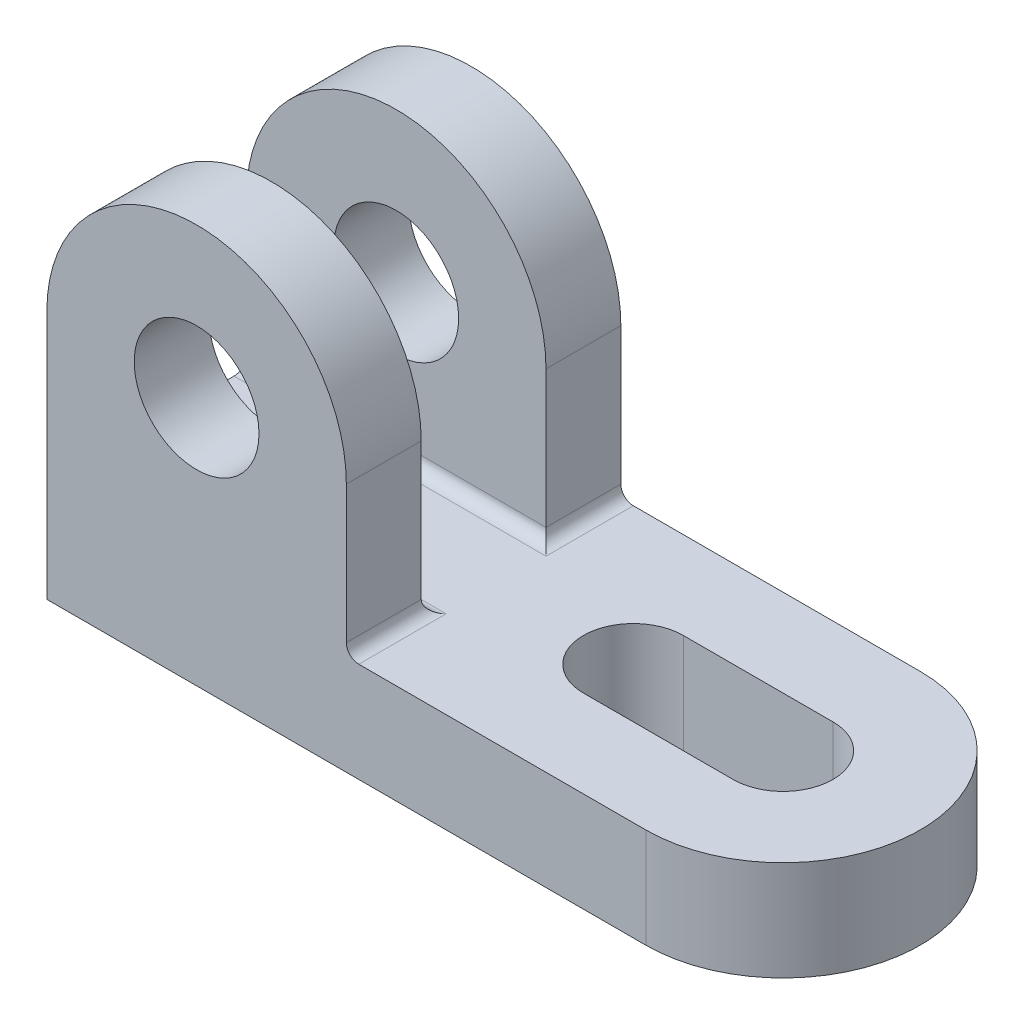
from build123d import *

# Parameters (mm, degrees)
BOSS_EXTRUDE1_DEPTH = 40.64
SKETCH2_W           = 121.92
SKETCH2_H           = 30.48
BOSS_EXTRUDE3_DEPTH = 121.92
CUT_EXTRUDE1_DEPTH  = 40.64
CUT_EXTRUDE3_DEPTH  = 111.76
SKETCH5_5_R         = 25.4
CUT_EXTRUDE4_DEPTH  = 111.76
FILLET1_R           = 5.08


with BuildPart() as part:
    # Sketch1 → Boss-Extrude1 (new body)
    with BuildSketch(Plane(origin=(0, 0, 0), x_dir=(1, 0, 0), z_dir=(0, 1, 0))):
        with BuildLine():
            Line((-43.798165138, 94.906788991), (200.041834862, 94.906788991))
            ThreePointArc((200.041834862, 94.906788991), (255.921834862, 39.026788991), (200.041834862, -16.853211009))
            Line((200.041834862, -16.853211009), (-43.798165138, -16.853211009))
            Line((-43.798165138, -16.853211009), (-43.798165138, 94.906788991))
        make_face()
    extrude(amount=BOSS_EXTRUDE1_DEPTH)

    # Sketch2 → Boss-Extrude3 (add)
    with BuildSketch(Plane(origin=(0, 40.64, 0), x_dir=(1, 0, 0), z_dir=(0, 1, 0))):
        with Locations((17.161834862, -1.613211009)):
            Rectangle(SKETCH2_W, SKETCH2_H)
        with Locations((17.161834862, 79.666788991)):
            Rectangle(SKETCH2_W, SKETCH2_H)
    extrude(amount=BOSS_EXTRUDE3_DEPTH)

    # Sketch2<6> → Cut-Extrude1 (cut)
    with BuildSketch(Plane(origin=(0, 40.64, 0), x_dir=(1, 0, 0), z_dir=(0, 1, 0))):
        with BuildLine():
            Line((200.041834862, 59.346788991), (139.081834862, 59.346788991))
            ThreePointArc((139.081834862, 59.346788991), (118.761834862, 39.026788991), (139.081834862, 18.706788991))
            Line((139.081834862, 18.706788991), (200.041834862, 18.706788991))
            ThreePointArc((200.041834862, 18.706788991), (220.361834862, 39.026788991), (200.041834862, 59.346788991))
        make_face()
    extrude(amount=-CUT_EXTRUDE1_DEPTH, mode=Mode.SUBTRACT)

    # Sketch5 → Cut-Extrude3 (cut)
    with BuildSketch(Plane.XY.offset(16.853211009)):
        with BuildLine():
            Line((78.121834862, 162.56), (17.161834862, 162.56))
            ThreePointArc((17.161834862, 162.56), (60.267064244, 144.705229381), (78.121834862, 101.6))
            Line((78.121834862, 101.6), (78.121834862, 162.56))
        make_face()
        with BuildLine():
            Line((-43.798165138, 162.56), (-43.798165138, 101.6))
            ThreePointArc((-43.798165138, 101.6), (-25.943394519, 144.705229381), (17.161834862, 162.56))
            Line((17.161834862, 162.56), (-43.798165138, 162.56))
        make_face()
    extrude(amount=-CUT_EXTRUDE3_DEPTH, mode=Mode.SUBTRACT)

    # Sketch5<5> → Cut-Extrude4 (cut)
    with BuildSketch(Plane.XY.offset(16.853211009)):
        with Locations((17.161834862, 101.6)):
            Circle(SKETCH5_5_R)
    extrude(amount=-CUT_EXTRUDE4_DEPTH, mode=Mode.SUBTRACT)

    # Fillet1
    fillet1_edges = [part.edges().sort_by_distance(p)[0] for p in [
        (78.121834862, 40.64, 1.613211009),
        (17.161834862, 40.64, -13.626788991),
        (17.161834862, 40.64, -64.426788991),
        (78.121834862, 40.64, -79.666788991),
    ]]
    fillet(fillet1_edges, radius=FILLET1_R)


solid = part.part
